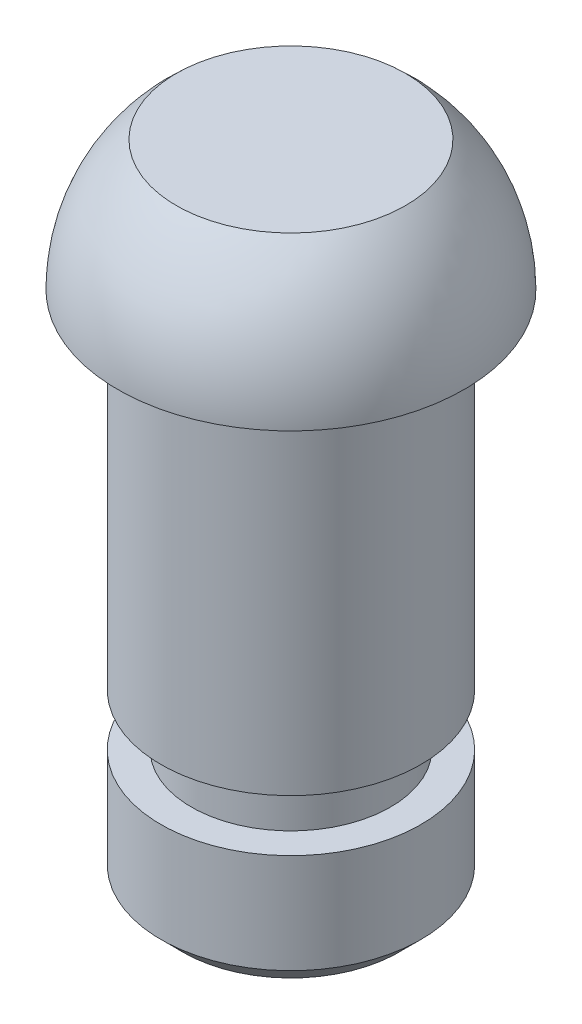
from build123d import *

# Parameters (mm, degrees)
CHAMFER1_SIZE = 0.25


with BuildPart() as part:
    # Sketch1 → Revolve2 (revolve)
    with BuildSketch(Plane.XY, mode=Mode.PRIVATE) as revolve2_sk:
        with BuildLine():
            Line((0, 0), (0, 6))
            Line((0, 6), (0, 7.5))
            Line((0, 7.5), (1.322875656, 7.5))
            ThreePointArc((1.322875656, 7.5), (1.822875656, 6.822875656), (2, 6))
            Line((2, 6), (1.5, 6))
            Line((1.5, 6), (1.5, 2))
            Line((1.5, 2), (1.15, 2))
            Line((1.15, 2), (1.15, 1.4))
            Line((1.15, 1.4), (1.5, 1.4))
            Line((1.5, 1.4), (1.5, 0))
            Line((1.5, 0), (0, 0))
        make_face()
    revolve(revolve2_sk.sketch.rotate(Axis((0, 0, 0), (0, 1, 0)), 90), axis=Axis((0, 0, 0), (0, 1, 0)))

    # Chamfer1
    chamfer1_edges = [part.edges().sort_by_distance(p)[0] for p in [
        (0, 0, 1.5),
    ]]
    chamfer(chamfer1_edges, length=CHAMFER1_SIZE)


solid = part.part
